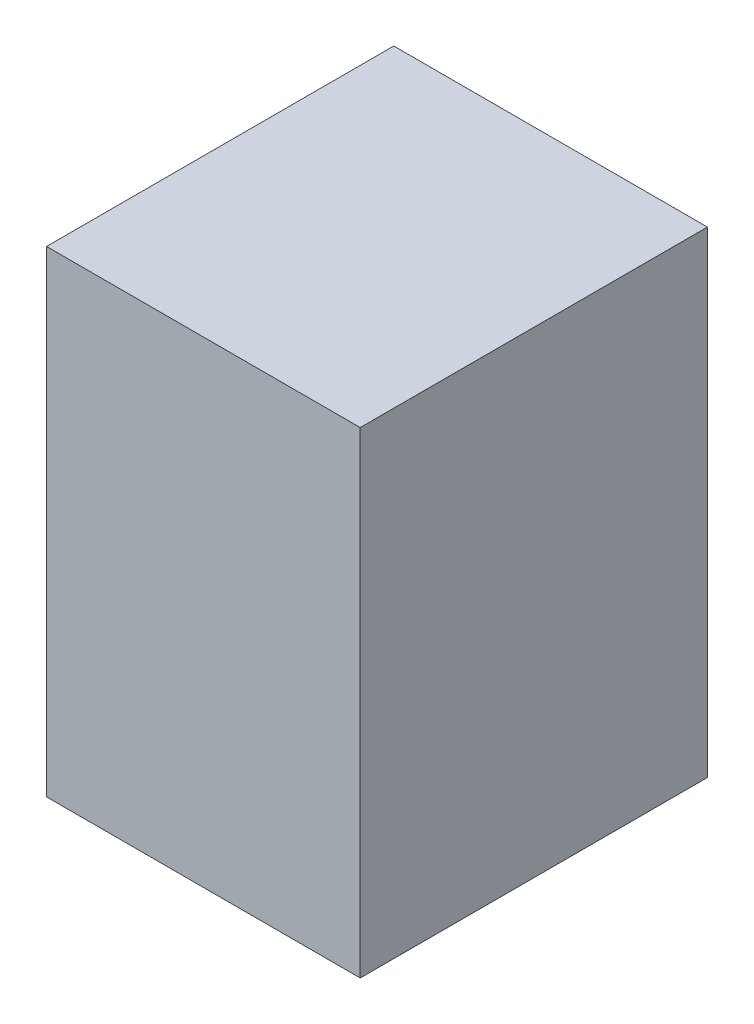
from build123d import *

# Parameters (mm, degrees)
SKETCH2_W           = 40.2
SKETCH2_H           = 61.1
BOSS_EXTRUDE1_DEPTH = 44.5


with BuildPart() as part:
    # Sketch2 → Boss-Extrude1 (new body)
    with BuildSketch(Plane.XY):
        Rectangle(SKETCH2_W, SKETCH2_H)
    extrude(amount=BOSS_EXTRUDE1_DEPTH)


solid = part.part
